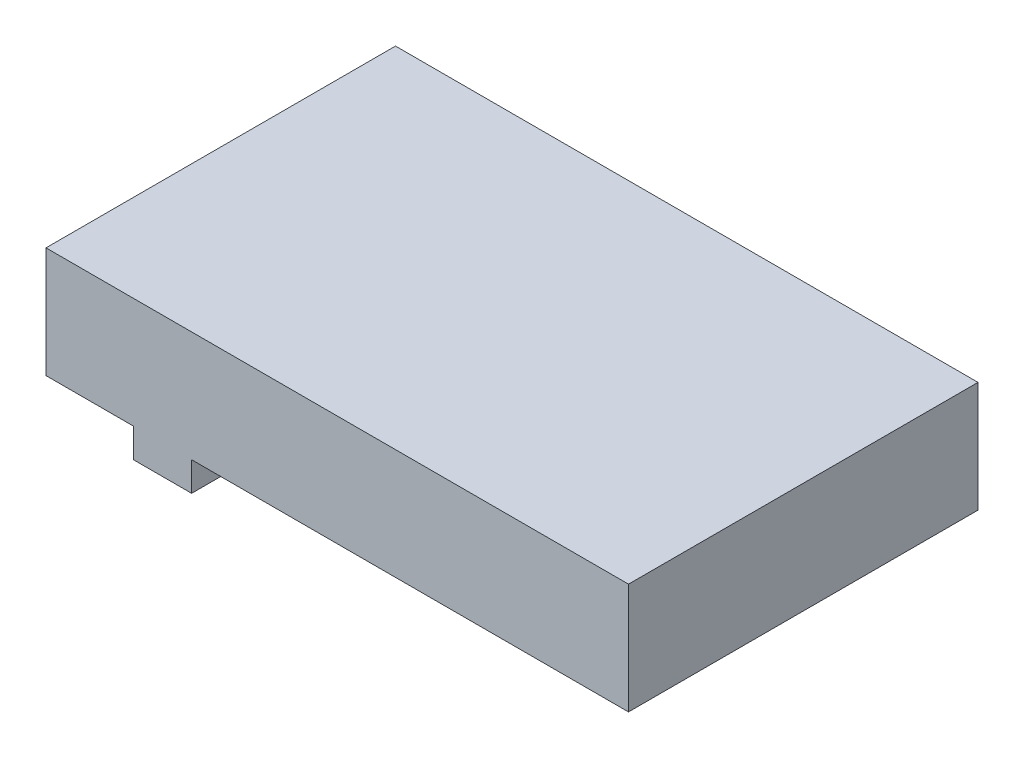
from build123d import *

# Parameters (mm, degrees)
SKETCH1_W           = 25.4
SKETCH1_H           = 4.826
BOSS_EXTRUDE1_DEPTH = 15.24
SKETCH2_W           = 2.54
SKETCH2_H           = 1.27
BOSS_EXTRUDE2_DEPTH = 15.24


with BuildPart() as part:
    # Sketch1 → Boss-Extrude1 (new body)
    with BuildSketch(Plane.XY):
        Rectangle(SKETCH1_W, SKETCH1_H)
    extrude(amount=BOSS_EXTRUDE1_DEPTH)

    # Sketch2 → Boss-Extrude2 (add)
    with BuildSketch(Plane.XY.offset(15.24)):
        with Locations((-7.62, -3.048)):
            Rectangle(SKETCH2_W, SKETCH2_H)
    extrude(amount=-BOSS_EXTRUDE2_DEPTH)


solid = part.part
